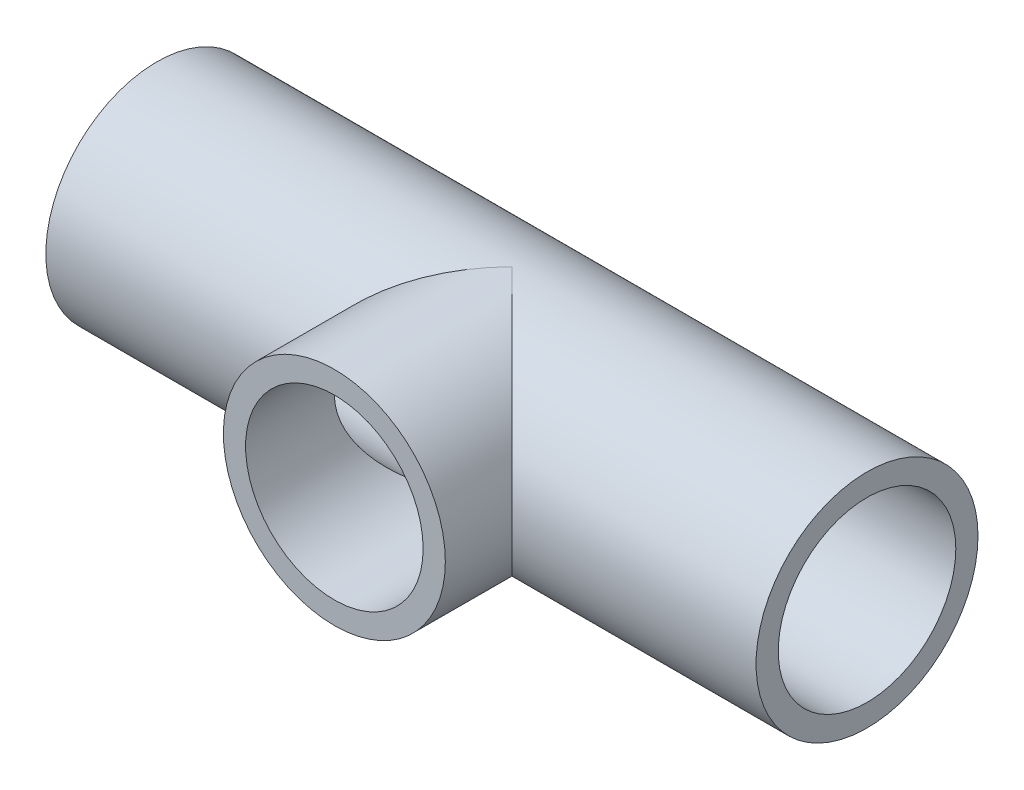
from build123d import *

# Parameters (mm, degrees)
SKETCH4_R           = 7.9375
BOSS_EXTRUDE2_DEPTH = 12.7
SKETCH7_R           = 6.35
CUT_EXTRUDE2_DEPTH  = 12.7
SKETCH8_R           = 7.9375
BOSS_EXTRUDE4_DEPTH = 25.4
SKETCH10_R          = 6.35
CUT_EXTRUDE4_DEPTH  = 12.7
SKETCH9_R           = 6.35
CUT_EXTRUDE5_DEPTH  = 53.961626757


with BuildPart() as part:
    # Sketch4 → Boss-Extrude2 (new body)
    with BuildSketch(Plane.XY):
        Circle(SKETCH4_R)
    extrude(amount=BOSS_EXTRUDE2_DEPTH)

    # Sketch7 → Cut-Extrude2 (cut)
    with BuildSketch(Plane.XY.offset(12.7)):
        Circle(SKETCH7_R)
    extrude(amount=-CUT_EXTRUDE2_DEPTH, mode=Mode.SUBTRACT)

    # Sketch8 → Boss-Extrude4 (add, symmetric)
    with BuildSketch(Plane(origin=(0, 0, 0), x_dir=(0, 0, -1), z_dir=(1, 0, 0))):
        Circle(SKETCH8_R)
    extrude(amount=BOSS_EXTRUDE4_DEPTH, both=True)

    # Sketch10 → Cut-Extrude4 (cut)
    with BuildSketch(Plane.XY.offset(12.7)):
        Circle(SKETCH10_R)
    extrude(amount=-CUT_EXTRUDE4_DEPTH, mode=Mode.SUBTRACT)

    # Sketch9 → Cut-Extrude5 (cut, through all)
    with BuildSketch(Plane(origin=(25.4, 0, 0), x_dir=(0, 0, -1), z_dir=(1, 0, 0))):
        Circle(SKETCH9_R)
    extrude(amount=-CUT_EXTRUDE5_DEPTH, mode=Mode.SUBTRACT)


solid = part.part
